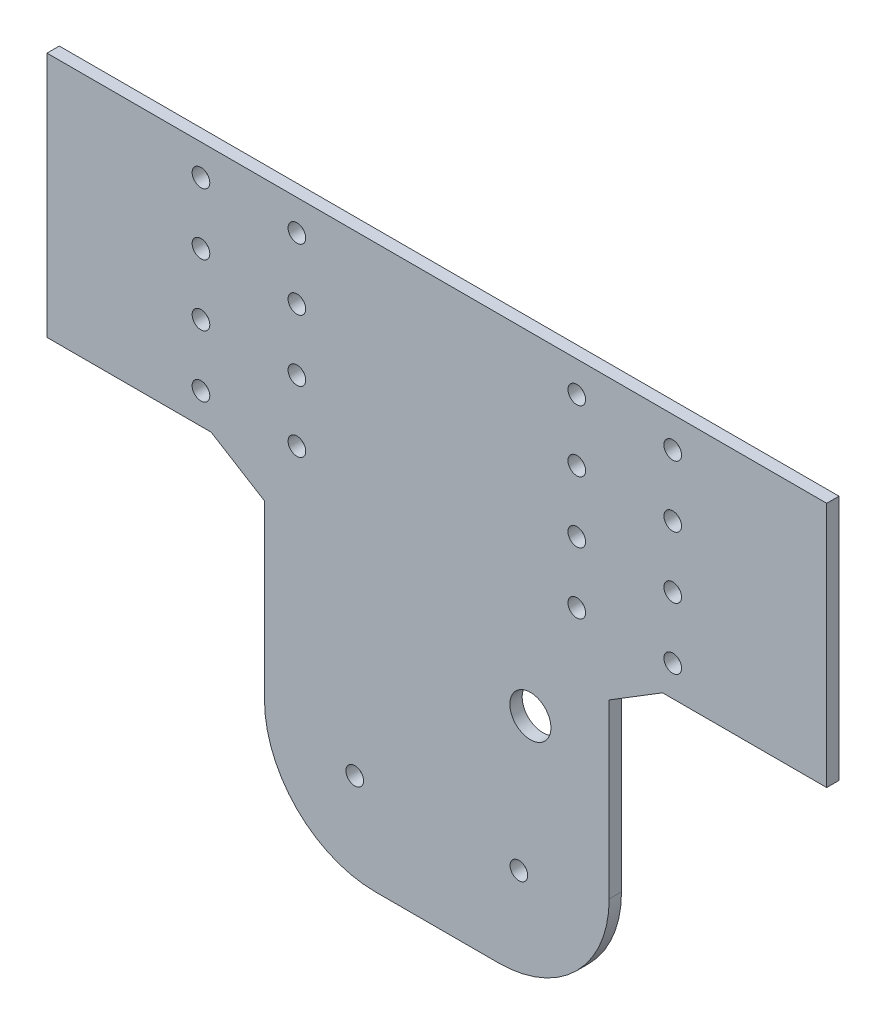
from build123d import *

# Parameters (mm, degrees)
EXTRUDE_1_DEPTH     = 3
CUT_EXTRUDE_1_REACH = 236.261
SKETCH_2_R          = 2.15
CHAMFER_1_SIZE      = 13
CHAMFER_1_SIZE2     = 8
CHAMFER_2_SIZE      = 8
CHAMFER_2_SIZE2     = 13
SKETCH_6_R          = 5
CUT_EXTRUDE_4_DEPTH = 10
SKETCH_7_R          = 2.15
CUT_EXTRUDE_5_DEPTH = 235.260538717


with BuildPart() as part:
    # 草图1 → 凸台-拉伸1 (new body)
    with BuildSketch(Plane.XY):
        with BuildLine():
            Line((0, 0), (0, -60))
            Line((0, -60), (53, -60))
            Line((53, -60), (53, -110))
            ThreePointArc((53, -110), (60.908116908, -129.091883092), (80, -137))
            Line((80, -137), (110, -137))
            ThreePointArc((110, -137), (129.091883092, -129.091883092), (137, -110))
            Line((137, -110), (137, -60))
            Line((137, -60), (190, -60))
            Line((190, -60), (190, 0))
            Line((190, 0), (0, 0))
        make_face()
    extrude(amount=EXTRUDE_1_DEPTH)

    # 草图2 → 切除-拉伸1 (cut, up to next)
    with BuildSketch(Plane.XY.offset(3), mode=Mode.PRIVATE) as cut_extrude_1_sk1:
        with Locations((75, -115)):
            Circle(SKETCH_2_R)
    cut_extrude_1_tool1 = extrude(cut_extrude_1_sk1.sketch, amount=-CUT_EXTRUDE_1_REACH, mode=Mode.PRIVATE) & part.part
    # 草图2 → 切除-拉伸1 (cut, up to next)
    with BuildSketch(Plane.XY.offset(3), mode=Mode.PRIVATE) as cut_extrude_1_sk2:
        with Locations((115, -115)):
            Circle(SKETCH_2_R)
    cut_extrude_1_tool2 = extrude(cut_extrude_1_sk2.sketch, amount=-CUT_EXTRUDE_1_REACH, mode=Mode.PRIVATE) & part.part
    add(cut_extrude_1_tool1.solids().sort_by_distance((75, -115, 3))[0], mode=Mode.SUBTRACT)
    add(cut_extrude_1_tool2.solids().sort_by_distance((115, -115, 3))[0], mode=Mode.SUBTRACT)

    # 倒角1
    chamfer_1_edges = [part.edges().sort_by_distance(p)[0] for p in [
        (53, -60, 1.5),
    ]]
    chamfer_1_side = [part.faces().sort_by_distance(p)[0] for p in [
        (26.5, -60, 1.5),
    ]]
    chamfer(chamfer_1_edges, length=CHAMFER_1_SIZE, length2=CHAMFER_1_SIZE2, reference=chamfer_1_side[0])

    # 倒角2
    chamfer_2_edges = [part.edges().sort_by_distance(p)[0] for p in [
        (137, -60, 1.5),
    ]]
    chamfer_2_side = [part.faces().sort_by_distance(p)[0] for p in [
        (137, -85, 1.5),
    ]]
    chamfer(chamfer_2_edges, length=CHAMFER_2_SIZE, length2=CHAMFER_2_SIZE2, reference=chamfer_2_side[0])

    # 草图6 → 切除-拉伸4 (cut)
    with BuildSketch(Plane(origin=(0, 0, 0), x_dir=(-1, 0, 0), z_dir=(0, 0, -1))):
        with Locations((-117.79084048, -81)):
            Circle(SKETCH_6_R)
    extrude(amount=-CUT_EXTRUDE_4_DEPTH, mode=Mode.SUBTRACT)

    # 草图7 → 切除-拉伸5 (cut, through all)
    with BuildSketch(Plane(origin=(0, 0, 0), x_dir=(-1, 0, 0), z_dir=(0, 0, -1))):
        with Locations((-129.1, -7.5)):
            Circle(SKETCH_7_R)
        with Locations((-152.48, -7.5)):
            Circle(SKETCH_7_R)
        with Locations((-152.48, -22.5)):
            Circle(SKETCH_7_R)
        with Locations((-129.1, -22.5)):
            Circle(SKETCH_7_R)
        with Locations((-152.48, -37.5)):
            Circle(SKETCH_7_R)
        with Locations((-129.1, -37.5)):
            Circle(SKETCH_7_R)
        with Locations((-152.48, -52.5)):
            Circle(SKETCH_7_R)
        with Locations((-129.1, -52.5)):
            Circle(SKETCH_7_R)
        with Locations((-60.9, -22.5)):
            Circle(SKETCH_7_R)
        with Locations((-37.52, -22.5)):
            Circle(SKETCH_7_R)
        with Locations((-60.9, -37.5)):
            Circle(SKETCH_7_R)
        with Locations((-37.52, -37.5)):
            Circle(SKETCH_7_R)
        with Locations((-60.9, -52.5)):
            Circle(SKETCH_7_R)
        with Locations((-37.52, -52.5)):
            Circle(SKETCH_7_R)
        with Locations((-60.9, -7.5)):
            Circle(SKETCH_7_R)
        with Locations((-37.52, -7.5)):
            Circle(SKETCH_7_R)
    extrude(amount=-CUT_EXTRUDE_5_DEPTH, mode=Mode.SUBTRACT)


solid = part.part
